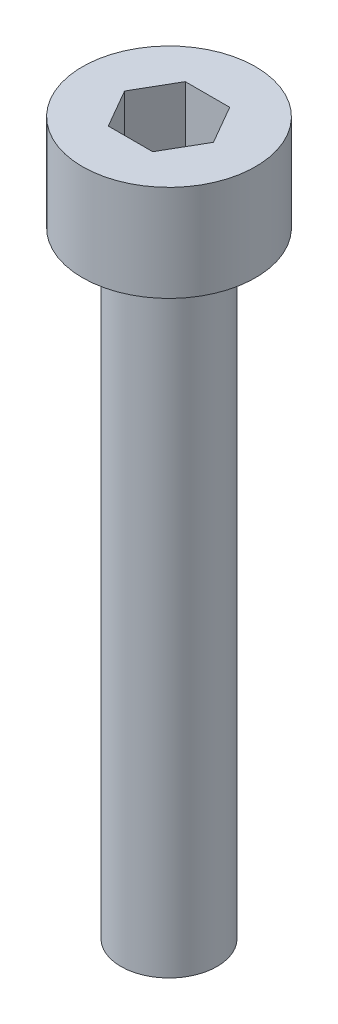
from build123d import *

# Parameters (mm, degrees)
CUT_EXTRUDE1_DEPTH = 1.5


with BuildPart() as part:
    # Sketch1 → Revolve1 (revolve)
    with BuildSketch(Plane.XY, mode=Mode.PRIVATE) as revolve1_sk:
        Polygon((0, -16), (1.25, -16), (1.25, 0), (2.25, 0), (2.25, 2.5), (0, 2.5), align=None)
    revolve(revolve1_sk.sketch.rotate(Axis((0, 61.691642626, 0), (0, -1, 0)), 90), axis=Axis((0, 61.691642626, 0), (0, -1, 0)))

    # Sketch2 → Cut-Extrude1 (cut)
    with BuildSketch(Plane(origin=(0, 2.5, 0), x_dir=(-1, 0, 0), z_dir=(0, 1, 0))):
        Polygon((-0.577350269, -1), (0.577350269, -1), (1.154700538, 0), (0.577350269, 1), (-0.577350269, 1), (-1.154700538, 0), align=None)
    extrude(amount=-CUT_EXTRUDE1_DEPTH, mode=Mode.SUBTRACT)


solid = part.part
